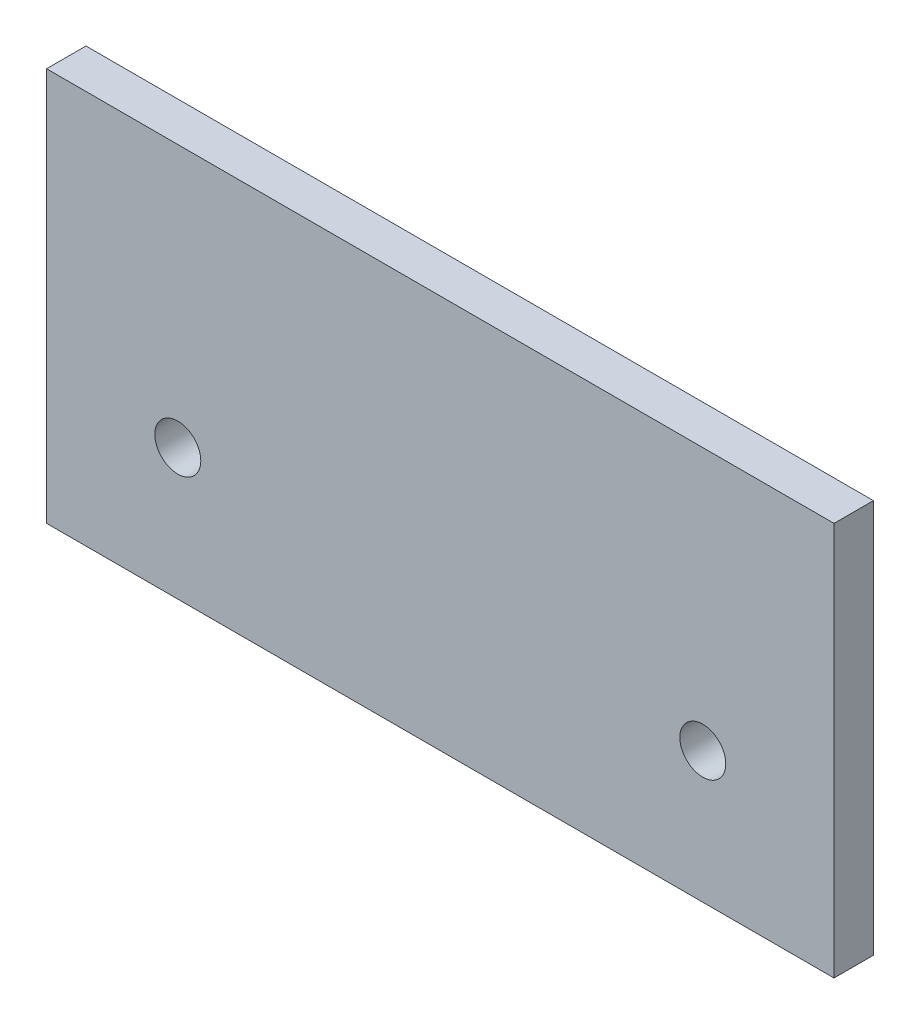
from build123d import *

# Parameters (mm, degrees)
SKETCH_1_W          = 60
SKETCH_1_H          = 30
EXTRUDE_1_DEPTH     = 3
SKETCH_2_R          = 1.75
CUT_EXTRUDE_2_DEPTH = 54.935146241


with BuildPart() as part:
    # 草圖1 → 伸長1 (new body)
    with BuildSketch(Plane.XY):
        with Locations((-20, 5)):
            Rectangle(SKETCH_1_W, SKETCH_1_H)
    extrude(amount=EXTRUDE_1_DEPTH)

    # 草圖2 → 伸長2 (cut, through all)
    with BuildSketch(Plane.XY.offset(3)):
        with Locations((-40, 0)):
            Circle(SKETCH_2_R)
        Circle(SKETCH_2_R)
    extrude(amount=-CUT_EXTRUDE_2_DEPTH, mode=Mode.SUBTRACT)


solid = part.part
